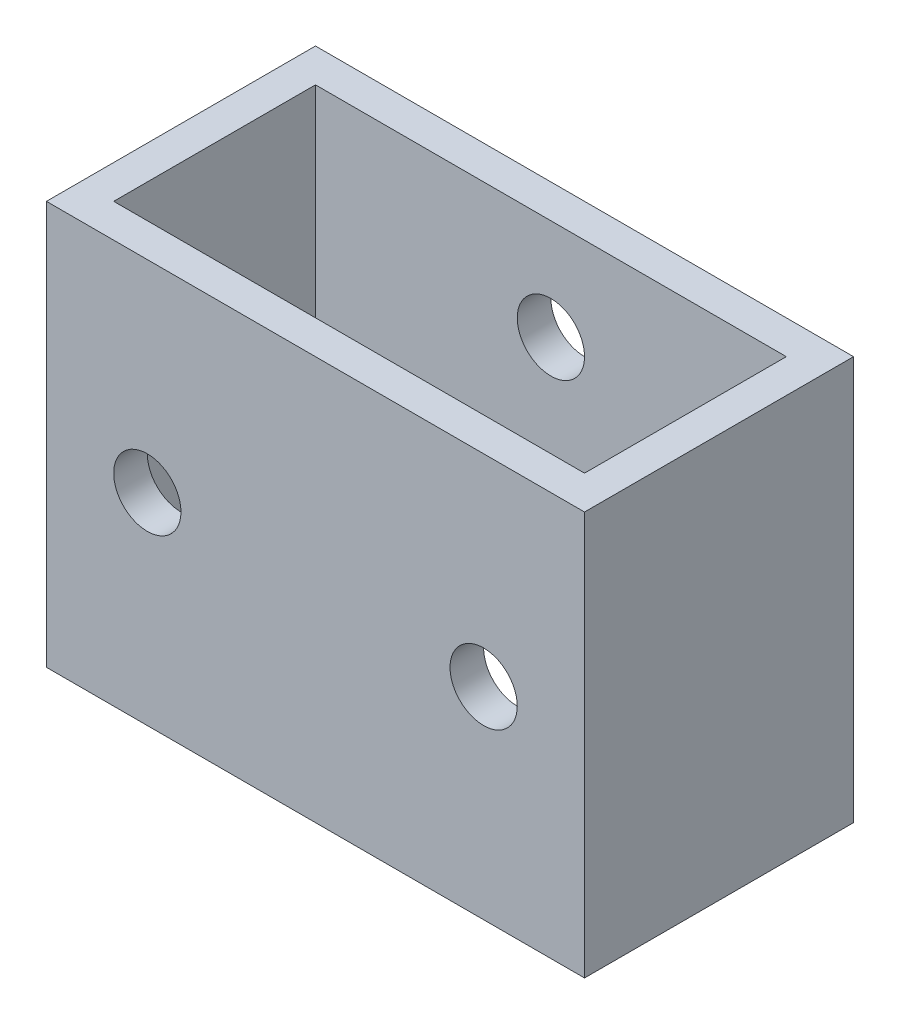
from build123d import *

# Parameters (mm, degrees)
SKETCH1_W           = 50.8
SKETCH1_H           = 25.4
SKETCH1_W_2         = 44.45
SKETCH1_H_2         = 19.05
BOSS_EXTRUDE1_DEPTH = 38.1
CUT_EXTRUDE1_REACH  = 54.363
SKETCH2_R           = 3.175
CUT_EXTRUDE2_REACH  = 54.363
SKETCH3_R           = 3.175


with BuildPart() as part:
    # Sketch1 → Boss-Extrude1 (new body)
    with BuildSketch(Plane(origin=(0, 0, 0), x_dir=(1, 0, 0), z_dir=(0, 1, 0))):
        Rectangle(SKETCH1_W, SKETCH1_H)
        Rectangle(SKETCH1_W_2, SKETCH1_H_2, mode=Mode.SUBTRACT)
    extrude(amount=BOSS_EXTRUDE1_DEPTH)

    # Sketch2 → Cut-Extrude1 (cut, up to next)
    with BuildSketch(Plane(origin=(0, 0, -12.7), x_dir=(-1, 0, 0), z_dir=(0, 0, -1)), mode=Mode.PRIVATE) as cut_extrude1_sk1:
        with Locations((0, 28.575)):
            Circle(SKETCH2_R)
    cut_extrude1_tool1 = extrude(cut_extrude1_sk1.sketch, amount=-CUT_EXTRUDE1_REACH, mode=Mode.PRIVATE) & part.part
    # Sketch2 → Cut-Extrude1 (cut, up to next)
    with BuildSketch(Plane(origin=(0, 0, -12.7), x_dir=(-1, 0, 0), z_dir=(0, 0, -1)), mode=Mode.PRIVATE) as cut_extrude1_sk2:
        with Locations((0, 9.525)):
            Circle(SKETCH2_R)
    cut_extrude1_tool2 = extrude(cut_extrude1_sk2.sketch, amount=-CUT_EXTRUDE1_REACH, mode=Mode.PRIVATE) & part.part
    add(cut_extrude1_tool1.solids().sort_by_distance((0, 28.575, -12.7))[0], mode=Mode.SUBTRACT)
    add(cut_extrude1_tool2.solids().sort_by_distance((0, 9.525, -12.7))[0], mode=Mode.SUBTRACT)

    # Sketch3 → Cut-Extrude2 (cut, up to next)
    with BuildSketch(Plane.XY.offset(12.7), mode=Mode.PRIVATE) as cut_extrude2_sk1:
        with Locations((15.875, 19.05)):
            Circle(SKETCH3_R)
    cut_extrude2_tool1 = extrude(cut_extrude2_sk1.sketch, amount=-CUT_EXTRUDE2_REACH, mode=Mode.PRIVATE) & part.part
    # Sketch3 → Cut-Extrude2 (cut, up to next)
    with BuildSketch(Plane.XY.offset(12.7), mode=Mode.PRIVATE) as cut_extrude2_sk2:
        with Locations((-15.875, 19.05)):
            Circle(SKETCH3_R)
    cut_extrude2_tool2 = extrude(cut_extrude2_sk2.sketch, amount=-CUT_EXTRUDE2_REACH, mode=Mode.PRIVATE) & part.part
    add(cut_extrude2_tool1.solids().sort_by_distance((15.875, 19.05, 12.7))[0], mode=Mode.SUBTRACT)
    add(cut_extrude2_tool2.solids().sort_by_distance((-15.875, 19.05, 12.7))[0], mode=Mode.SUBTRACT)


solid = part.part
